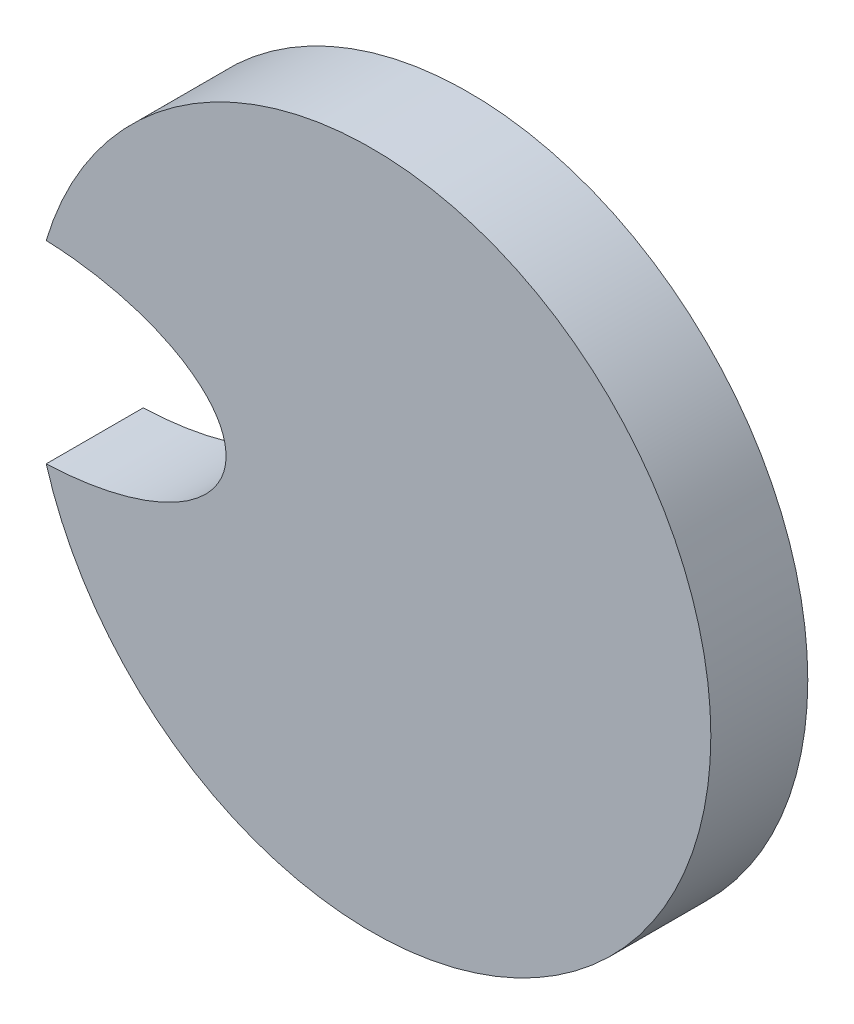
from build123d import *

# Parameters (mm, degrees)
SKETCH1_R           = 35
BOSS_EXTRUDE1_DEPTH = 10
SKETCH2_RX          = 20
SKETCH2_RY          = 10
CUT_EXTRUDE1_DEPTH  = 20


with BuildPart() as part:
    # Sketch1 → Boss-Extrude1 (new body)
    with BuildSketch(Plane.XY):
        Circle(SKETCH1_R)
    extrude(amount=BOSS_EXTRUDE1_DEPTH)

    # Sketch2 → Cut-Extrude1 (cut)
    with BuildSketch(Plane.XY.offset(10)):
        with Locations(Location((-35, 0), (0, 0, 0))):
            Ellipse(SKETCH2_RX, SKETCH2_RY)
    extrude(amount=-CUT_EXTRUDE1_DEPTH, mode=Mode.SUBTRACT)


solid = part.part
